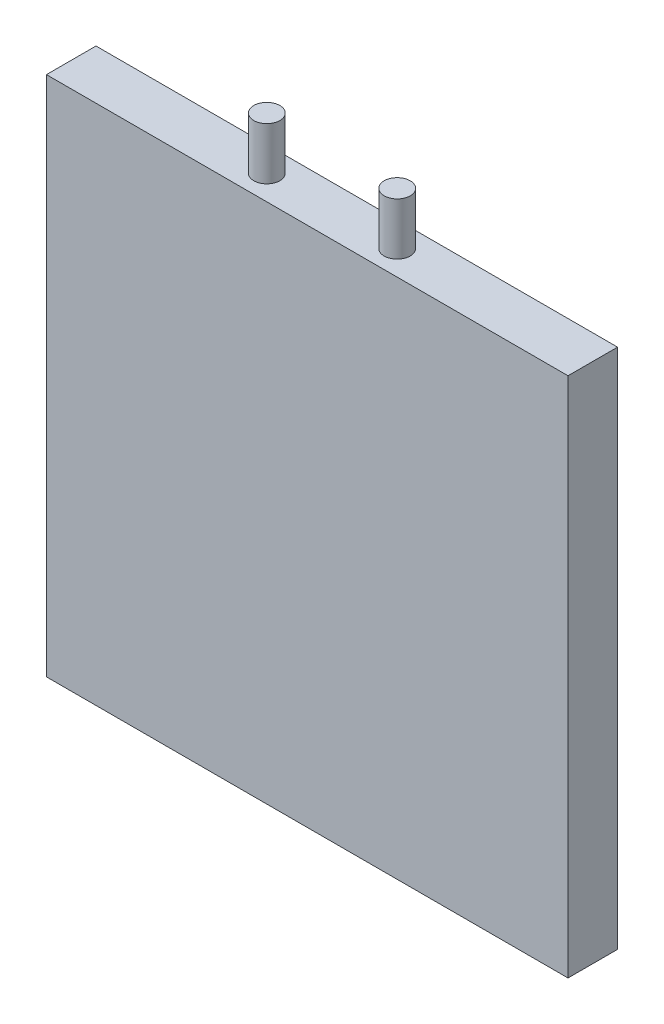
from build123d import *

# Parameters (mm, degrees)
SKETCH_1_W      = 40
SKETCH_1_H      = 40
EXTRUDE_1_DEPTH = 3.8
SKETCH_3_R      = 1
EXTRUDE_3_DEPTH = 4
SKETCH_4_R      = 1
EXTRUDE_4_DEPTH = 4


with BuildPart() as part:
    # 草图1 → 凸台-拉伸1 (new body)
    with BuildSketch(Plane.XY):
        Rectangle(SKETCH_1_W, SKETCH_1_H)
    extrude(amount=EXTRUDE_1_DEPTH)

    # 草图3 → 凸台-拉伸3 (add)
    with BuildSketch(Plane(origin=(0, 20, 0), x_dir=(1, 0, 0), z_dir=(0, 1, 0))):
        with Locations(Location((5, -1.9, 0), (0, 0, 90))):
            Circle(SKETCH_3_R)
    extrude(amount=EXTRUDE_3_DEPTH)

    # 草图4 → 凸台-拉伸4 (add)
    with BuildSketch(Plane(origin=(0, 20, 0), x_dir=(1, 0, 0), z_dir=(0, 1, 0))):
        with Locations(Location((-5, -1.9, 0), (0, 0, 90))):
            Circle(SKETCH_4_R)
    extrude(amount=EXTRUDE_4_DEPTH)


solid = part.part
